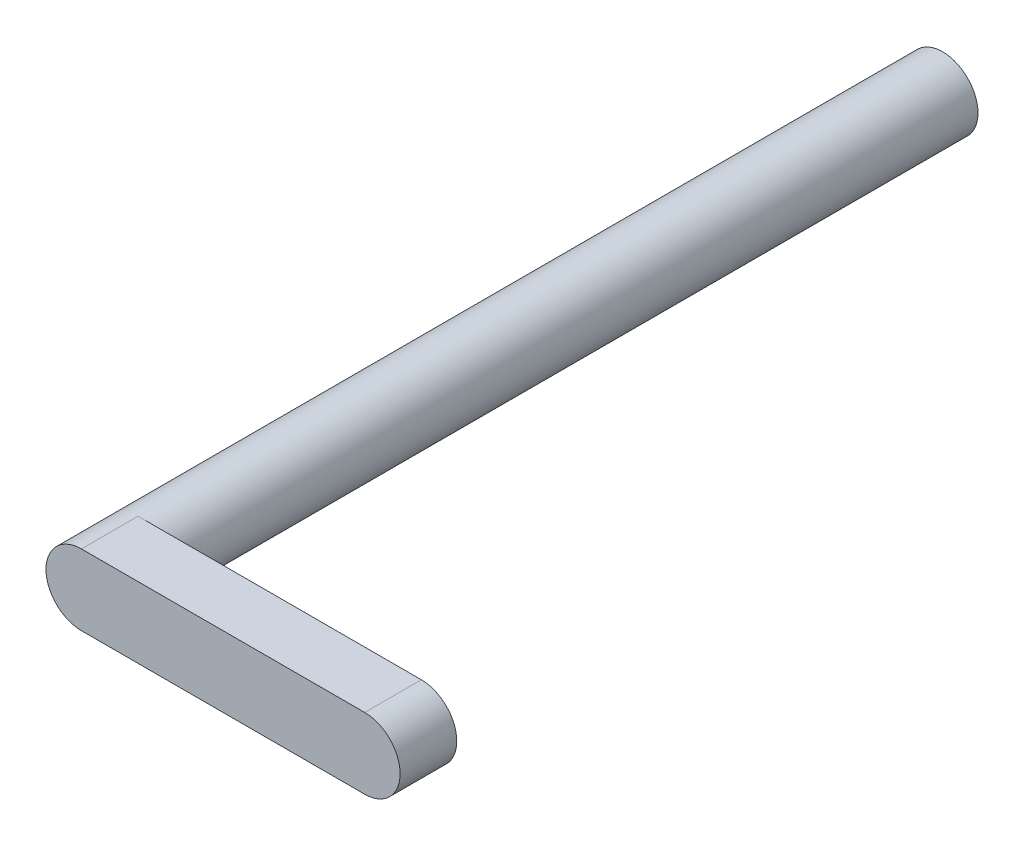
from build123d import *

# Parameters (mm, degrees)
SKETCH1_R           = 0.79375
BOSS_EXTRUDE1_DEPTH = 19.304
BOSS_EXTRUDE5_START = -1.27
BOSS_EXTRUDE5_DEPTH = 1.27


with BuildPart() as part:
    # Sketch1 → Boss-Extrude1 (new body)
    with BuildSketch(Plane.XY):
        Circle(SKETCH1_R)
    extrude(amount=BOSS_EXTRUDE1_DEPTH)

    # Sketch3 → Boss-Extrude5 (add)
    with BuildSketch(Plane.XY.offset(19.304).offset(BOSS_EXTRUDE5_START)):
        with BuildLine():
            Line((0, 0.79375), (6.35, 0.79375))
            ThreePointArc((6.35, 0.79375), (7.14375, 0), (6.35, -0.79375))
            Line((6.35, -0.79375), (0, -0.79375))
            ThreePointArc((0, -0.79375), (-0.79375, 0), (0, 0.79375))
        make_face()
    extrude(amount=BOSS_EXTRUDE5_DEPTH)


solid = part.part
